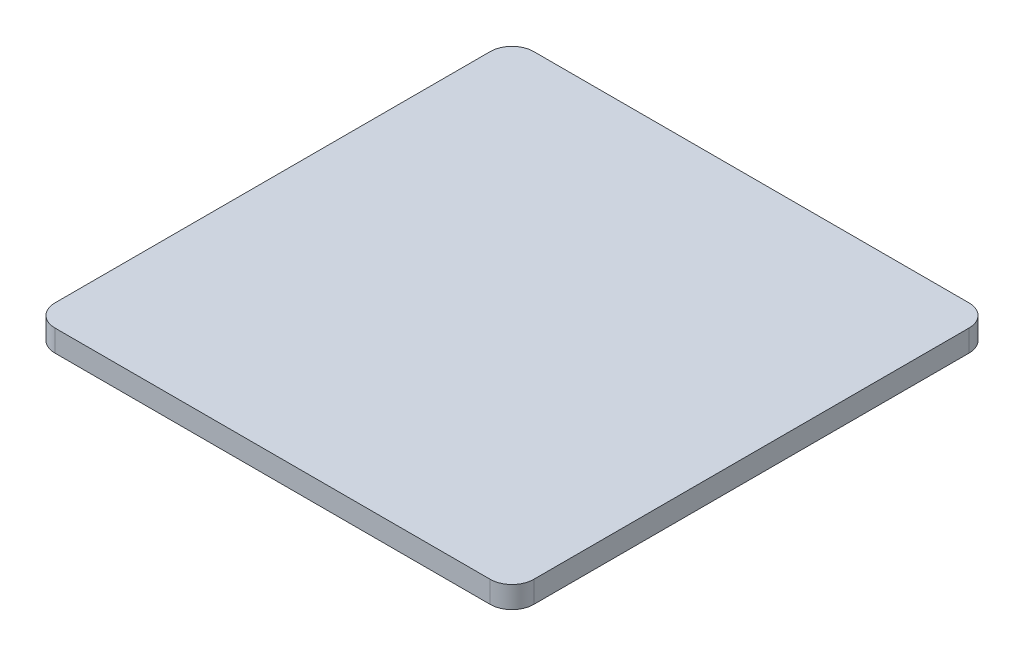
from build123d import *

# Parameters (mm, degrees)
SKETCH1_W           = 220
SKETCH1_H           = 220
BOSS_EXTRUDE1_DEPTH = 10
FILLET1_R           = 10


with BuildPart() as part:
    # Sketch1 → Boss-Extrude1 (new body)
    with BuildSketch(Plane(origin=(0, 0, 0), x_dir=(1, 0, 0), z_dir=(0, 1, 0))):
        Rectangle(SKETCH1_W, SKETCH1_H)
    extrude(amount=BOSS_EXTRUDE1_DEPTH)

    # Fillet1
    fillet1_edges = [part.edges().sort_by_distance(p)[0] for p in [
        (110, 5, 110),
        (-110, 5, 110),
        (-110, 5, -110),
        (110, 5, -110),
    ]]
    fillet(fillet1_edges, radius=FILLET1_R)


solid = part.part
